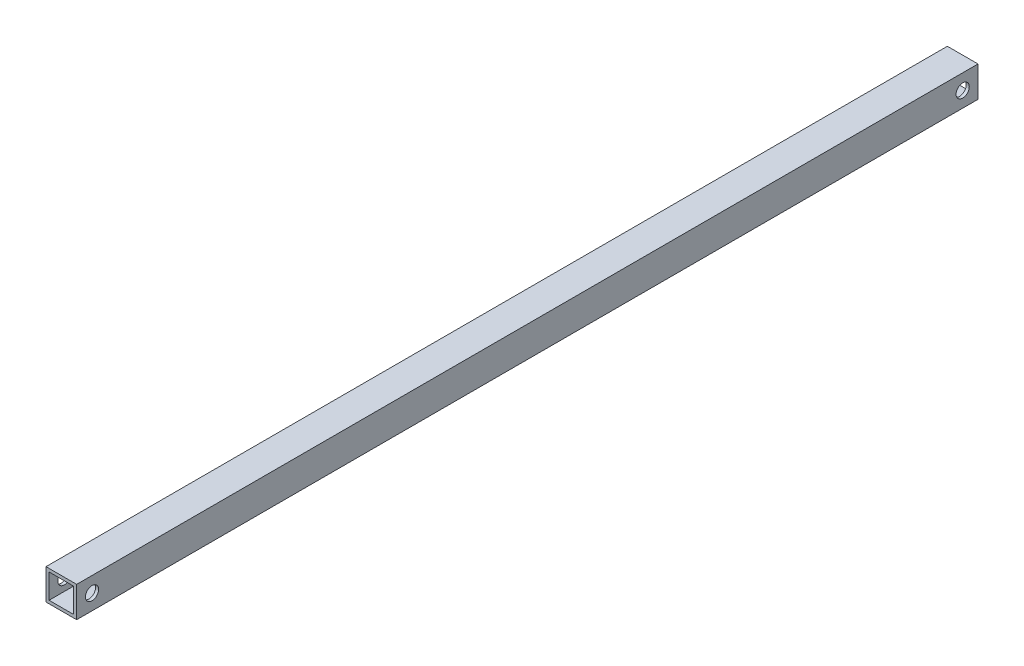
from build123d import *

# Parameters (mm, degrees)
SKETCH_1_W          = 10
SKETCH_1_H          = 10
SKETCH_1_W_2        = 8
SKETCH_1_H_2        = 8
EXTRUDE_1_DEPTH     = 294
SKETCH_2_R          = 2.15
CUT_EXTRUDE_1_DEPTH = 295.212508232


with BuildPart() as part:
    # ｽｹｯﾁ1 → 押し出し-薄板1 (new body)
    with BuildSketch(Plane.XY):
        Rectangle(SKETCH_1_W, SKETCH_1_H)
        Rectangle(SKETCH_1_W_2, SKETCH_1_H_2, mode=Mode.SUBTRACT)
    extrude(amount=EXTRUDE_1_DEPTH)

    # ｽｹｯﾁ2 → ｶｯﾄ - 押し出し1 (cut, through all)
    with BuildSketch(Plane(origin=(5, 0, 0), x_dir=(0, 0, -1), z_dir=(1, 0, 0))):
        with Locations(Location((-5, 0, 0), (0, 0, 90))):
            Circle(SKETCH_2_R)
        with Locations(Location((-289, 0, 0), (0, 0, 90))):
            Circle(SKETCH_2_R)
    extrude(amount=-CUT_EXTRUDE_1_DEPTH, mode=Mode.SUBTRACT)


solid = part.part
